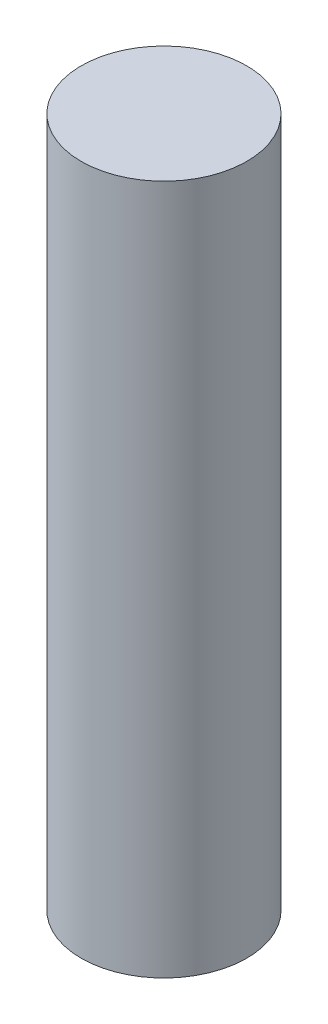
from build123d import *

# Parameters (mm, degrees)
SKETCH1_R           = 18
BOSS_EXTRUDE1_DEPTH = 150


with BuildPart() as part:
    # Sketch1 → Boss-Extrude1 (new body)
    with BuildSketch(Plane(origin=(0, 0, 0), x_dir=(1, 0, 0), z_dir=(0, 1, 0))):
        with Locations(Location((0, 0, 0), (0, 0, 270))):
            Circle(SKETCH1_R)
    extrude(amount=BOSS_EXTRUDE1_DEPTH)


solid = part.part
